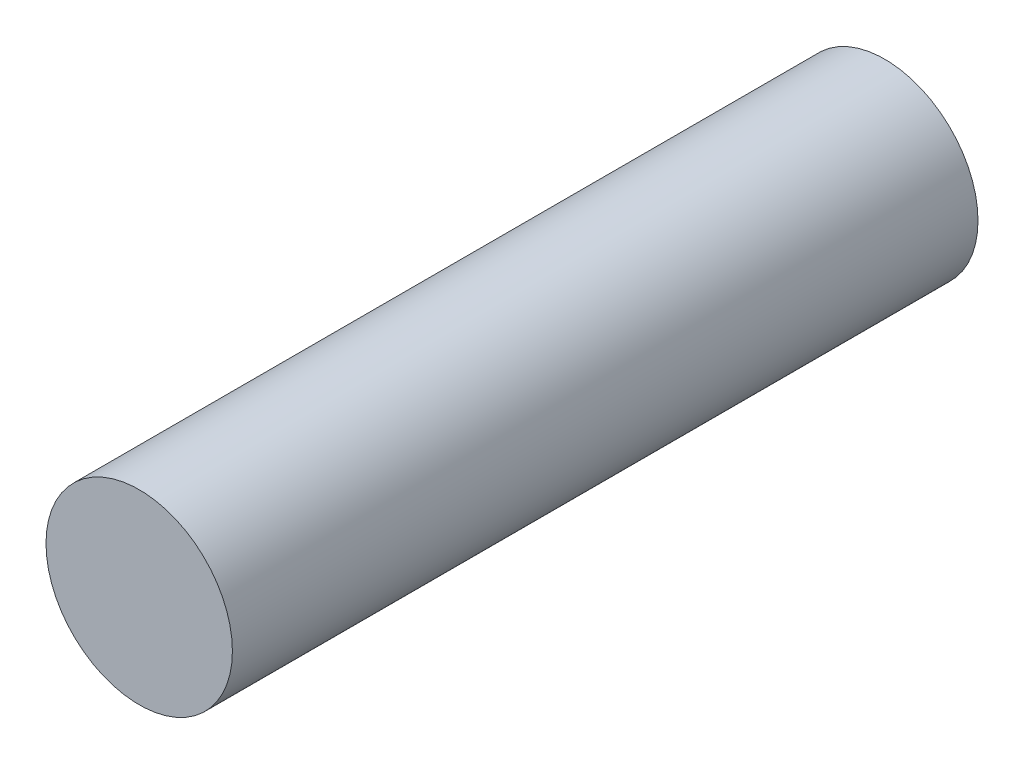
from build123d import *

# Parameters (mm, degrees)
SKETCH1_R           = 75
BOSS_EXTRUDE1_DEPTH = 600
SKETCH2_R           = 37.5
CUT_EXTRUDE1_DEPTH  = 500


with BuildPart() as part:
    # Sketch1 → Boss-Extrude1 (new body)
    with BuildSketch(Plane.XY):
        Circle(SKETCH1_R)
    extrude(amount=BOSS_EXTRUDE1_DEPTH)

    # Sketch2 → Cut-Extrude1 (cut)
    with BuildSketch(Plane(origin=(0, 0, 0), x_dir=(-1, 0, 0), z_dir=(0, 0, -1))):
        Circle(SKETCH2_R)
    extrude(amount=-CUT_EXTRUDE1_DEPTH, mode=Mode.SUBTRACT)


solid = part.part
